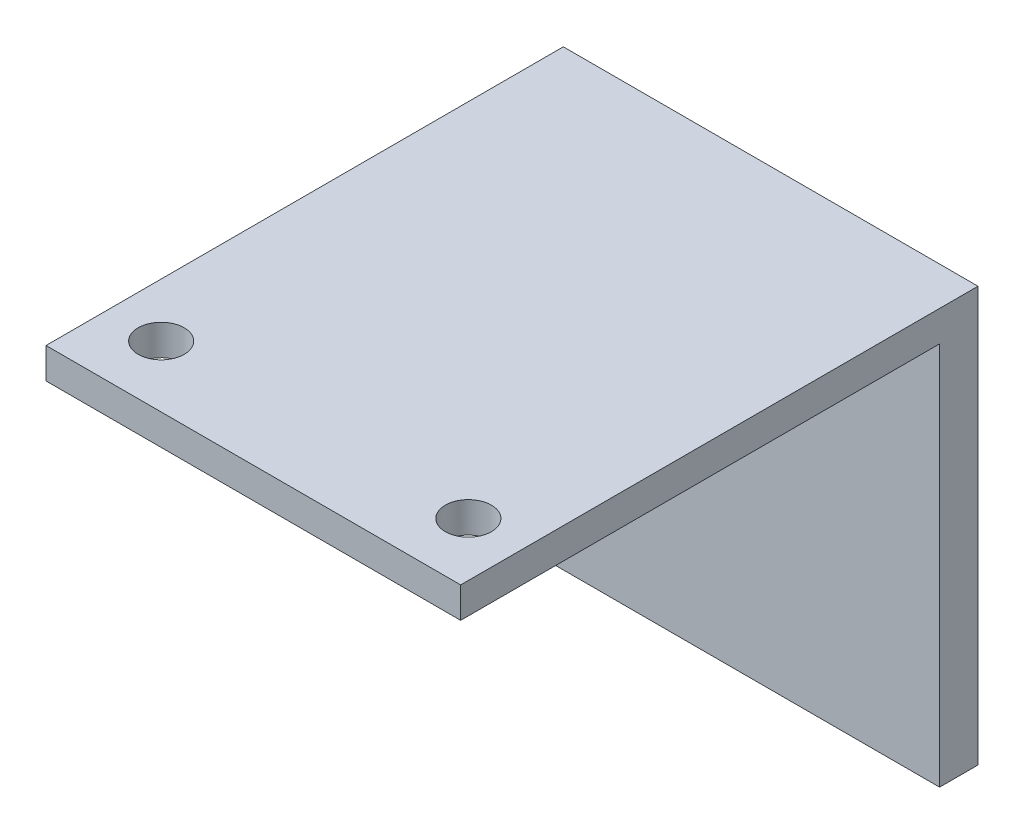
from build123d import *

# Parameters (mm, degrees)
ESQUISSE1_W             = 54
ESQUISSE1_H             = 54
BOSS_EXTRU_1_DEPTH      = 67.37
ESQUISSE2_W             = 85.887974464
ESQUISSE2_H             = 58.790343592
ENL_V_MAT_EXTRU_1_DEPTH = 62.37
ESQUISSE3_R             = 3
ENL_V_MAT_EXTRU_2_DEPTH = 62.37
D_GAGEMENT_M61_D        = 6.6


with BuildPart() as part:
    # Esquisse1 → Boss.-Extru.1 (new body)
    with BuildSketch(Plane.XY):
        Rectangle(ESQUISSE1_W, ESQUISSE1_H)
    extrude(amount=BOSS_EXTRU_1_DEPTH)

    # Esquisse2 → Enlèv. mat.-Extru.1 (cut)
    with BuildSketch(Plane.XY.offset(67.37)):
        with Locations((-4.168944697, -6.395171796)):
            Rectangle(ESQUISSE2_W, ESQUISSE2_H)
    extrude(amount=-ENL_V_MAT_EXTRU_1_DEPTH, mode=Mode.SUBTRACT)

    # Esquisse3 → Enlèv. mat.-Extru.2 (cut)
    with BuildSketch(Plane.XZ.offset(-23)):
        with Locations(Location((-20, 59.37, 0), (0, 0, 270))):
            Circle(ESQUISSE3_R)
        with Locations(Location((20, 59.37, 0), (0, 0, 270))):
            Circle(ESQUISSE3_R)
    extrude(amount=-ENL_V_MAT_EXTRU_2_DEPTH, mode=Mode.SUBTRACT)

    # Dégagement M61 (through all)
    with Locations(Plane(origin=(0, 0, 0), x_dir=(-1, 0, 0), z_dir=(0, 0, -1))):
        with Locations((20.562817304, -15.5), (20.562817304, 16.5)):
            Hole(D_GAGEMENT_M61_D / 2)


solid = part.part
